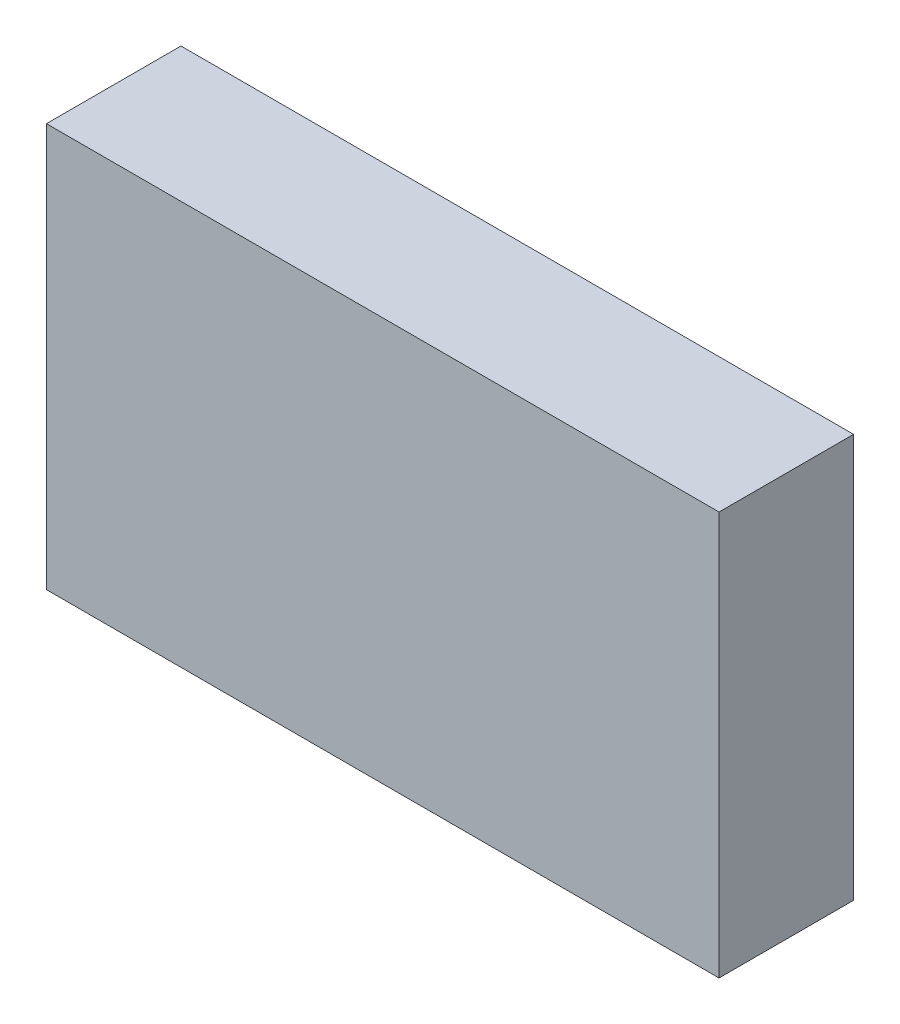
from build123d import *

# Parameters (mm, degrees)
SKETCH1_W         = 100
SKETCH1_H         = 60
SIMPLEBLOCK_DEPTH = 20


with BuildPart() as part:
    # Sketch1 → SimpleBlock (new body)
    with BuildSketch(Plane.XY):
        with Locations((50, 30)):
            Rectangle(SKETCH1_W, SKETCH1_H)
    extrude(amount=SIMPLEBLOCK_DEPTH)


solid = part.part
